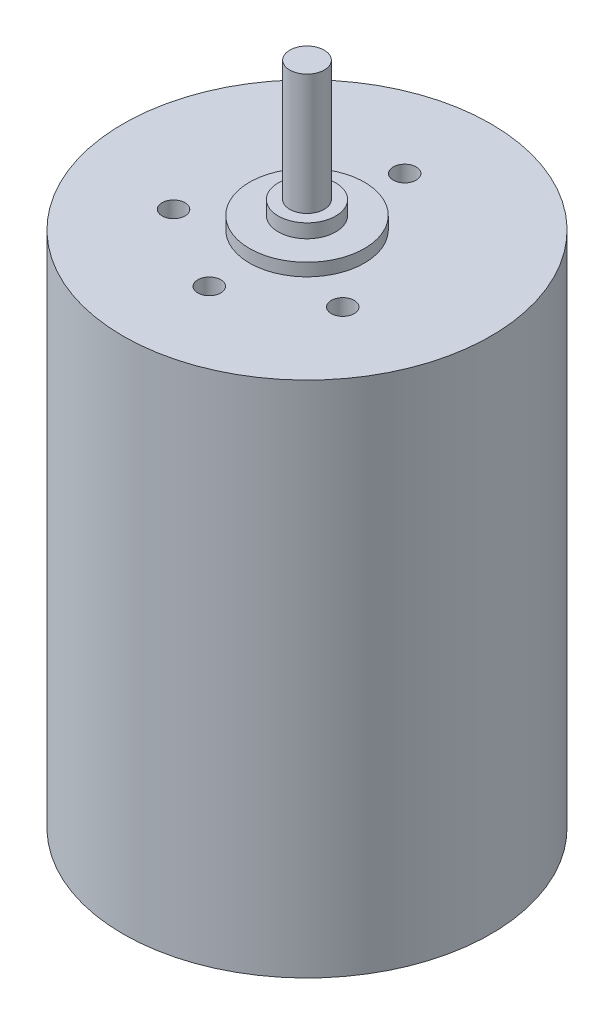
from build123d import *

# Parameters (mm, degrees)
SKETCH1_R           = 16
BOSS_EXTRUDE1_DEPTH = 45.05
SKETCH3_R           = 5
BOSS_EXTRUDE2_DEPTH = 1.1
SKETCH4_R           = 2.5
BOSS_EXTRUDE3_DEPTH = 1.2
SKETCH5_R           = 1.5
BOSS_EXTRUDE4_DEPTH = 10.5
SKETCH6_R           = 1
CUT_EXTRUDE1_DEPTH  = 3.6


with BuildPart() as part:
    # Sketch1 → Boss-Extrude1 (new body)
    with BuildSketch(Plane(origin=(0, 0, 0), x_dir=(1, 0, 0), z_dir=(0, 1, 0))):
        with Locations(Location((0, 0, 0), (0, 0, 270))):
            Circle(SKETCH1_R)
    extrude(amount=-BOSS_EXTRUDE1_DEPTH)

    # Sketch3 → Boss-Extrude2 (add)
    with BuildSketch(Plane(origin=(0, 0, 0), x_dir=(1, 0, 0), z_dir=(0, 1, 0))):
        with Locations(Location((0, 0, 0), (0, 0, 270))):
            Circle(SKETCH3_R)
    extrude(amount=BOSS_EXTRUDE2_DEPTH)

    # Sketch4 → Boss-Extrude3 (add)
    with BuildSketch(Plane(origin=(0, 1.1, 0), x_dir=(1, 0, 0), z_dir=(0, 1, 0))):
        with Locations(Location((0, 0, 0), (0, 0, 270))):
            Circle(SKETCH4_R)
    extrude(amount=BOSS_EXTRUDE3_DEPTH)

    # Sketch5 → Boss-Extrude4 (add)
    with BuildSketch(Plane(origin=(0, 2.3, 0), x_dir=(1, 0, 0), z_dir=(0, 1, 0))):
        with Locations(Location((0, 0, 0), (0, 0, 90))):
            Circle(SKETCH5_R)
    extrude(amount=BOSS_EXTRUDE4_DEPTH)

    # Sketch6 → Cut-Extrude1 (cut)
    with BuildSketch(Plane(origin=(0, 0, 0), x_dir=(1, 0, 0), z_dir=(0, 1, 0))):
        with Locations(Location((0, 8.5, 0), (0, 0, 270))):
            Circle(SKETCH6_R)
        with Locations(Location((0, -8.5, 0), (0, 0, 270))):
            Circle(SKETCH6_R)
        with Locations(Location((-7.361215932, -4.25, 0), (0, 0, 270))):
            Circle(SKETCH6_R)
        with Locations(Location((7.361215932, -4.25, 0), (0, 0, 270))):
            Circle(SKETCH6_R)
    extrude(amount=-CUT_EXTRUDE1_DEPTH, mode=Mode.SUBTRACT)


solid = part.part
